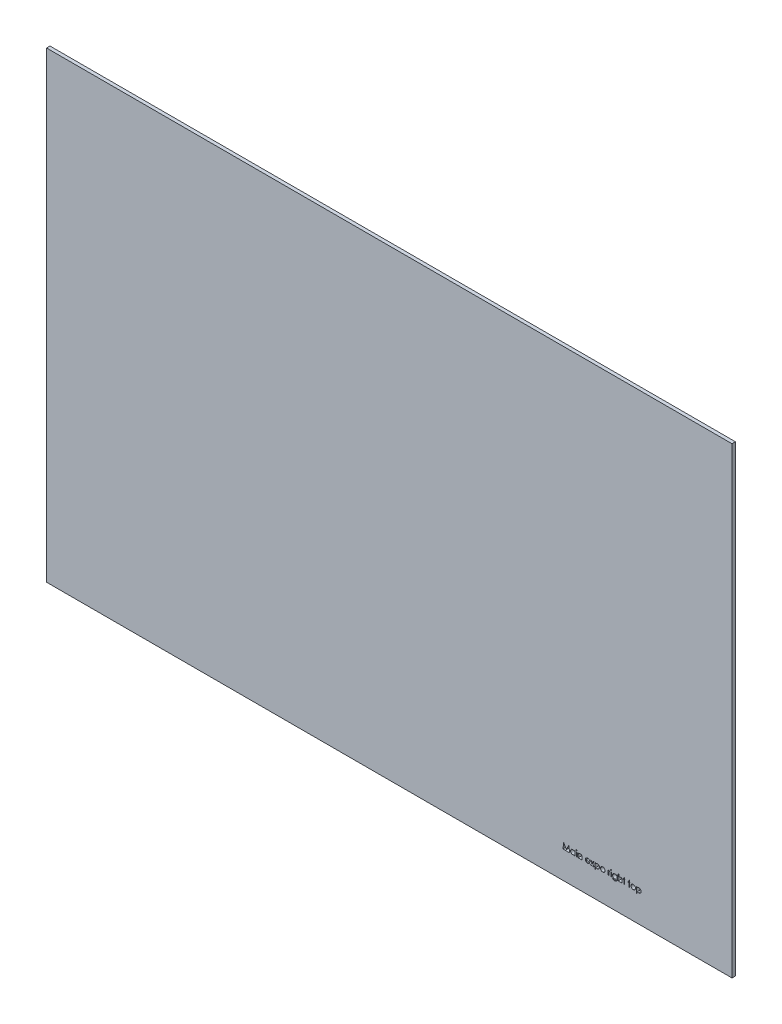
from build123d import *

# Parameters (mm, degrees)
SKETCH1_W           = 400
SKETCH1_H           = 270
SKETCH1_W_2         = 0.314102564
SKETCH1_H_2         = 2.557692307
BOSS_EXTRUDE1_DEPTH = 2


with BuildPart() as part:
    # Sketch1 → Boss-Extrude1 (new body)
    with BuildSketch(Plane.XY):
        with Locations((200, -135)):
            Rectangle(SKETCH1_W, SKETCH1_H)
        with BuildLine():
            Line((319.995968107, -255.076583311), (319.995968107, -254.134275618))
            Line((319.995968107, -254.134275618), (319.995968107, -251.576583311))
            Line((319.995968107, -251.576583311), (320.310070671, -251.576583311))
            Line((320.310070671, -251.576583311), (320.310070671, -252.049840522))
            add(Edge.make_bspline(
                [(320.310070671, -252.049840522), (320.372235907, -251.964531074), (320.476663599, -251.848597496), (320.637941677, -251.724426255), (320.765057448, -251.65299669), (320.899490655, -251.599232933), (321.090725815, -251.545083732), (321.241803533, -251.532032963), (321.343524197, -251.531711516)],
                knots=[0, 0, 0, 0, 0.263044683, 0.386061082, 0.505770653, 0.625178031, 0.746147722, 1, 1, 1, 1], degree=3))
            add(Edge.make_bspline(
                [(321.343524197, -251.531711516), (321.433156928, -251.532609638), (321.566440546, -251.542569377), (321.73787464, -251.583337397), (321.859440999, -251.626704901), (321.976704515, -251.680369288), (322.087926497, -251.748083907), (322.194840071, -251.826490765), (322.29475631, -251.916722734), (322.38707746, -252.014351041), (322.46692443, -252.119373365), (322.535793493, -252.228335836), (322.591474208, -252.342928363), (322.635043597, -252.462245964), (322.677017831, -252.629991443), (322.687762725, -252.760597629), (322.6882758, -252.848418247)],
                knots=[0, 0, 0, 0, 0.128636051, 0.190652902, 0.252125037, 0.313446276, 0.375227279, 0.438498083, 0.5032851, 0.568009687, 0.630878982, 0.692153504, 0.75255215, 0.813191094, 0.8739854, 1, 1, 1, 1], degree=3))
            add(Edge.make_bspline(
                [(322.6882758, -252.848418247), (322.68807256, -252.937927497), (322.676551747, -253.070614701), (322.635897379, -253.241335405), (322.592882575, -253.362612068), (322.537229457, -253.478595879), (322.469528043, -253.589202236), (322.389640712, -253.694395935), (322.298339823, -253.792748894), (322.199286828, -253.883347975), (322.093409334, -253.962586881), (321.982350481, -254.029125216), (321.866678034, -254.084719337), (321.774567384, -254.1165056), (321.721723316, -254.131166929), (321.709885967, -254.134275618)],
                knots=[0, 0, 0, 0, 0.128034164, 0.189573725, 0.250579835, 0.311733221, 0.37325008, 0.435762516, 0.500345561, 0.564949367, 0.627527909, 0.68915729, 0.749865012, 0.8107602, 0.828257924, 0.828257924, 0.828257924, 0.828257924], degree=3))
            add(Edge.make_bspline(
                [(321.709885967, -254.134275618), (321.680091316, -254.142100201), (321.562862278, -254.168565726), (321.442587513, -254.178824696), (321.353339902, -254.179147413)],
                knots=[0.828257924, 0.828257924, 0.828257924, 0.828257924, 0.872299761, 1, 1, 1, 1], degree=3))
            add(Edge.make_bspline(
                [(321.353339902, -254.179147413), (321.252869694, -254.180307326), (321.134853659, -254.166667728), (321.019952148, -254.138824764), (321.002728251, -254.134275618)],
                knots=[0, 0, 0, 0, 0.250547782, 0.295016817, 0.295016817, 0.295016817, 0.295016817], degree=3))
            Line((321.002728251, -254.134275618), (320.310070671, -254.134275618))
            Line((320.310070671, -254.134275618), (320.310070671, -255.076583311))
            Line((320.310070671, -255.076583311), (319.995968107, -255.076583311))
        make_face(mode=Mode.SUBTRACT)
        with BuildLine():
            Line((332.535646453, -254.134275618), (331.537835094, -254.134275618))
            add(Edge.make_bspline(
                [(331.537835094, -254.134275618), (331.479680934, -254.134540059), (331.39302235, -254.128306537), (331.279037529, -254.110758262), (331.195429259, -254.091703257), (331.113173797, -254.067204444), (331.032406164, -254.03658962), (330.952472649, -254.00197398), (330.874826148, -253.961201318), (330.800240018, -253.915838973), (330.729276833, -253.866700093), (330.662308294, -253.814041802), (330.599971804, -253.757344863), (330.542349133, -253.69669133), (330.488665264, -253.632727777), (330.439807922, -253.564561036), (330.394774513, -253.493434077), (330.355717034, -253.418873157), (330.3214324, -253.342495047), (330.291623967, -253.264463145), (330.267854932, -253.184515888), (330.249717439, -253.102704848), (330.231505925, -252.990517565), (330.227252695, -252.904600959), (330.226737338, -252.847016003)],
                knots=[0, 0, 0, 0, 0.085222258, 0.127202284, 0.169025313, 0.210882033, 0.252962678, 0.295628285, 0.338553294, 0.381463248, 0.423581562, 0.465066165, 0.506312219, 0.547039505, 0.587675833, 0.628674786, 0.669946465, 0.711035574, 0.751995829, 0.792672607, 0.833446018, 0.874190607, 0.915493583, 1, 1, 1, 1], degree=3))
            add(Edge.make_bspline(
                [(330.226737338, -252.847016003), (330.226464852, -252.789083269), (330.232806195, -252.702929503), (330.25003313, -252.589510855), (330.270214112, -252.506803918), (330.294543809, -252.425179379), (330.324665449, -252.345238866), (330.360884731, -252.266958372), (330.401894337, -252.190279836), (330.447978469, -252.116232222), (330.498510939, -252.045905576), (330.553552816, -251.979817404), (330.612344731, -251.917300982), (330.675604548, -251.85895949), (330.743299541, -251.804934523), (330.814762421, -251.754320505), (330.890214671, -251.708209136), (330.968492058, -251.667427006), (331.047605883, -251.630213984), (331.12860409, -251.600681421), (331.209976732, -251.574652595), (331.293156266, -251.556238694), (331.405260538, -251.53714447), (331.490716063, -251.531776726), (331.5476508, -251.531711516)],
                knots=[0, 0, 0, 0, 0.083905433, 0.125068934, 0.16615847, 0.207210273, 0.248490732, 0.289878112, 0.332169514, 0.374475842, 0.41622498, 0.457609587, 0.49907317, 0.540553362, 0.582248849, 0.62454975, 0.667432801, 0.710322543, 0.752467119, 0.794064757, 0.835215707, 0.876228344, 0.917446189, 1, 1, 1, 1], degree=3))
            add(Edge.make_bspline(
                [(331.5476508, -251.531711516), (331.640531381, -251.531863906), (331.77868943, -251.544955171), (331.956285329, -251.590323045), (332.084188836, -251.638284072), (332.209060718, -251.703862889), (332.377592631, -251.823461064), (332.488472606, -251.940243821), (332.560070671, -252.023899016)],
                knots=[0, 0, 0, 0, 0.238762229, 0.354754859, 0.470359399, 0.589144099, 0.716328905, 1, 1, 1, 1], degree=3))
            Line((332.560070671, -252.023899016), (332.560070671, -251.576583311))
            Line((332.560070671, -251.576583311), (332.874173235, -251.576583311))
            Line((332.874173235, -251.576583311), (332.874173235, -253.606330907))
            add(Edge.make_bspline(
                [(332.874173235, -253.606330907), (332.873722516, -253.68975743), (332.872661296, -253.81057464), (332.861386146, -253.965171401), (332.853096871, -254.05780118), (332.845702438, -254.113056729), (332.842503185, -254.134275618)],
                knots=[0, 0, 0, 0, 0.315488713, 0.456290824, 0.58586415, 0.666969388, 0.666969388, 0.666969388, 0.666969388], degree=3))
            add(Edge.make_bspline(
                [(332.842503185, -254.134275618), (332.840986131, -254.144337405), (332.834909414, -254.182593869), (332.818497, -254.269179699), (332.798128101, -254.344552122), (332.780924037, -254.390886195)],
                knots=[0.666969388, 0.666969388, 0.666969388, 0.666969388, 0.705428686, 0.813370713, 1, 1, 1, 1], degree=3))
            add(Edge.make_bspline(
                [(332.780924037, -254.390886195), (332.760248172, -254.447986981), (332.722622072, -254.530186413), (332.660149905, -254.631989833), (332.607370328, -254.702437215), (332.548222241, -254.767409466), (332.484142708, -254.828334183), (332.41387198, -254.883918146), (332.337453416, -254.933203529), (332.256647741, -254.977590447), (332.171501657, -255.016037482), (332.082495187, -255.049522547), (331.988792407, -255.074612179), (331.891861743, -255.096320454), (331.7546507, -255.115620125), (331.649267336, -255.12197483), (331.577799037, -255.121455106)],
                knots=[0, 0, 0, 0, 0.120906468, 0.179423665, 0.237606687, 0.295938468, 0.354218227, 0.413537067, 0.474086783, 0.535121189, 0.596987665, 0.660019834, 0.724277496, 0.79001185, 0.857747684, 1, 1, 1, 1], degree=3))
            add(Edge.make_bspline(
                [(331.577799037, -255.121455106), (331.474425993, -255.122811659), (331.322960115, -255.109694402), (331.127977585, -255.071836642), (330.994401737, -255.030185934), (330.87113211, -254.979135226), (330.759007697, -254.920543806), (330.659038179, -254.853353097), (330.568908834, -254.776854764), (330.48758963, -254.685882906), (330.38003632, -254.535459342), (330.313251955, -254.406108783), (330.271609133, -254.313762798)],
                knots=[0, 0, 0, 0, 0.188473675, 0.276839915, 0.362136562, 0.443436755, 0.520165521, 0.592709664, 0.662917334, 0.7354188, 0.81488097, 1, 1, 1, 1], degree=3))
            Line((330.271609133, -254.313762798), (330.585711697, -254.313762798))
            add(Edge.make_bspline(
                [(330.585711697, -254.313762798), (330.631798719, -254.394086677), (330.716407758, -254.503068478), (330.853963056, -254.62050614), (330.967379876, -254.690463303), (331.093619245, -254.743126709), (331.286332854, -254.795408981), (331.441352104, -254.806851959), (331.5476508, -254.807352541)],
                knots=[0, 0, 0, 0, 0.243805374, 0.360061534, 0.475112, 0.593525098, 0.71935017, 1, 1, 1, 1], degree=3))
            add(Edge.make_bspline(
                [(331.5476508, -254.807352541), (331.653031522, -254.806800902), (331.80684535, -254.795259382), (331.998431579, -254.743120503), (332.122988418, -254.690548394), (332.232045007, -254.626089123), (332.326056804, -254.554091177), (332.40220152, -254.472909656), (332.453414498, -254.398127968), (332.485249071, -254.331503822), (332.50552147, -254.274151231), (332.521994729, -254.209298345), (332.53108144, -254.161741137), (332.535376899, -254.135911988), (332.535646453, -254.134275618)],
                knots=[0, 0, 0, 0, 0.189264436, 0.274463056, 0.355023171, 0.430920462, 0.501086045, 0.566607627, 0.629720863, 0.662710695, 0.698765562, 0.738610537, 0.782581228, 0.785554543, 0.785554543, 0.785554543, 0.785554543], degree=3))
        make_face(mode=Mode.SUBTRACT)
        with BuildLine():
            Line((344.316480928, -255.076583311), (344.316480928, -254.134275618))
            Line((344.316480928, -254.134275618), (344.316480928, -251.576583311))
            Line((344.316480928, -251.576583311), (344.630583492, -251.576583311))
            Line((344.630583492, -251.576583311), (344.630583492, -252.049840522))
            add(Edge.make_bspline(
                [(344.630583492, -252.049840522), (344.692748727, -251.964531074), (344.797176419, -251.848597496), (344.958454498, -251.724426255), (345.085570268, -251.65299669), (345.220003475, -251.599232933), (345.411238635, -251.545083732), (345.562316354, -251.532032963), (345.664037018, -251.531711516)],
                knots=[0, 0, 0, 0, 0.263044683, 0.386061082, 0.505770653, 0.625178031, 0.746147722, 1, 1, 1, 1], degree=3))
            add(Edge.make_bspline(
                [(345.664037018, -251.531711516), (345.753669748, -251.532609638), (345.886953367, -251.542569377), (346.058387461, -251.583337397), (346.179953819, -251.626704901), (346.297217336, -251.680369288), (346.408439317, -251.748083907), (346.515352891, -251.826490765), (346.61526913, -251.916722734), (346.707590281, -252.014351041), (346.78743725, -252.119373365), (346.856306313, -252.228335836), (346.911987028, -252.342928363), (346.955556417, -252.462245964), (346.997530651, -252.629991443), (347.008275545, -252.760597629), (347.00878862, -252.848418247)],
                knots=[0, 0, 0, 0, 0.128636051, 0.190652902, 0.252125037, 0.313446276, 0.375227279, 0.438498083, 0.5032851, 0.568009687, 0.630878982, 0.692153504, 0.75255215, 0.813191094, 0.8739854, 1, 1, 1, 1], degree=3))
            add(Edge.make_bspline(
                [(347.00878862, -252.848418247), (347.008585381, -252.937927497), (346.997064568, -253.070614701), (346.956410199, -253.241335405), (346.913395395, -253.362612068), (346.857742277, -253.478595879), (346.790040863, -253.589202236), (346.710153533, -253.694395935), (346.618852644, -253.792748894), (346.519799649, -253.883347975), (346.413922155, -253.962586881), (346.302863301, -254.029125216), (346.187190855, -254.084719337), (346.095080205, -254.1165056), (346.042236137, -254.131166929), (346.030398788, -254.134275618)],
                knots=[0, 0, 0, 0, 0.128034164, 0.189573725, 0.250579835, 0.311733221, 0.37325008, 0.435762516, 0.500345561, 0.564949367, 0.627527909, 0.68915729, 0.749865012, 0.8107602, 0.828257924, 0.828257924, 0.828257924, 0.828257924], degree=3))
            add(Edge.make_bspline(
                [(346.030398788, -254.134275618), (346.000604136, -254.142100201), (345.883375098, -254.168565726), (345.763100334, -254.178824696), (345.673852723, -254.179147413)],
                knots=[0.828257924, 0.828257924, 0.828257924, 0.828257924, 0.872299761, 1, 1, 1, 1], degree=3))
            add(Edge.make_bspline(
                [(345.673852723, -254.179147413), (345.573382515, -254.180307326), (345.455366479, -254.166667728), (345.340464969, -254.138824764), (345.323241072, -254.134275618)],
                knots=[0, 0, 0, 0, 0.250547782, 0.295016817, 0.295016817, 0.295016817, 0.295016817], degree=3))
            Line((345.323241072, -254.134275618), (344.630583492, -254.134275618))
            Line((344.630583492, -254.134275618), (344.630583492, -255.076583311))
            Line((344.630583492, -255.076583311), (344.316480928, -255.076583311))
        make_face(mode=Mode.SUBTRACT)
        Polygon((301.64550737, -254.134275618), (301.329301441, -254.134275618), (301.791340703, -250.634275618), (301.836212498, -250.634275618), (303.281224518, -253.50607049), (304.722730928, -250.634275618), (304.768303844, -250.634275618), (305.233147594, -254.134275618), (304.917642787, -254.134275618), (303.319085094, -254.134275618), (303.248271793, -254.134275618), align=None, mode=Mode.SUBTRACT)
        with BuildLine():
            add(Edge.make_bspline(
                [(307.105142787, -254.179147413), (307.016113375, -254.178929314), (306.896102302, -254.168499992), (306.779102683, -254.142095512), (306.749312124, -254.134275618)],
                knots=[0, 0, 0, 0, 0.127433484, 0.171490765, 0.171490765, 0.171490765, 0.171490765], degree=3))
            add(Edge.make_bspline(
                [(306.749312124, -254.134275618), (306.737469977, -254.131167106), (306.684620394, -254.116511138), (306.59250591, -254.084717858), (306.476833535, -254.029125471), (306.365773497, -253.962587374), (306.259900804, -253.883345677), (306.160829205, -253.792757888), (306.069597444, -253.69436284), (305.98953531, -253.589417297), (305.922785362, -253.478375036), (305.86695368, -253.362641709), (305.824000635, -253.241327439), (305.783324059, -253.070620258), (305.771817125, -252.937924603), (305.771609133, -252.848418247)],
                knots=[0.171490765, 0.171490765, 0.171490765, 0.171490765, 0.189004127, 0.249930071, 0.310668454, 0.372328961, 0.43493911, 0.499575544, 0.564191208, 0.626735217, 0.688109334, 0.749293607, 0.810330528, 0.87190117, 1, 1, 1, 1], degree=3))
            add(Edge.make_bspline(
                [(305.771609133, -252.848418247), (305.772126786, -252.760600483), (305.782858261, -252.629985932), (305.824854092, -252.462253916), (305.868363059, -252.342898651), (305.924215406, -252.228558153), (305.992140665, -252.119154246), (306.072160576, -252.014384828), (306.164412766, -251.916713559), (306.264347587, -251.826493135), (306.371256333, -251.748083394), (306.482479508, -251.680369065), (306.599742924, -251.62670629), (306.721308504, -251.583332026), (306.892521139, -251.542652541), (307.02554526, -251.532509137), (307.114958492, -251.531711516)],
                knots=[0, 0, 0, 0, 0.12607881, 0.186904093, 0.247573935, 0.308003356, 0.369131898, 0.432033228, 0.496790794, 0.561610823, 0.624913866, 0.686726349, 0.748078833, 0.809582291, 0.871630743, 1, 1, 1, 1], degree=3))
            add(Edge.make_bspline(
                [(307.114958492, -251.531711516), (307.217151175, -251.532010486), (307.368894506, -251.545130551), (307.560892283, -251.599109485), (307.695555358, -251.652971118), (307.822691908, -251.724661935), (307.984614908, -251.847816075), (308.087884307, -251.964882651), (308.149814261, -252.049840522)],
                knots=[0, 0, 0, 0, 0.254653531, 0.376014554, 0.495255252, 0.614797719, 0.738105554, 1, 1, 1, 1], degree=3))
            Line((308.149814261, -252.049840522), (308.149814261, -251.576583311))
            Line((308.149814261, -251.576583311), (308.463916825, -251.576583311))
            Line((308.463916825, -251.576583311), (308.463916825, -254.134275618))
            Line((308.463916825, -254.134275618), (308.149814261, -254.134275618))
            Line((308.149814261, -254.134275618), (307.470279114, -254.134275618))
            add(Edge.make_bspline(
                [(307.470279114, -254.134275618), (307.448256384, -254.139956853), (307.328429012, -254.167735765), (307.205378966, -254.179954764), (307.105142787, -254.179147413)],
                knots=[0.69099225, 0.69099225, 0.69099225, 0.69099225, 0.748144942, 1, 1, 1, 1], degree=3))
        make_face(mode=Mode.SUBTRACT)
        with Locations((309.29404503, -252.855429464)):
            Rectangle(SKETCH1_W_2, SKETCH1_H_2, mode=Mode.SUBTRACT)
        with BuildLine():
            Line((310.528019389, -254.134275618), (310.213916825, -254.134275618))
            Line((310.213916825, -254.134275618), (310.213916825, -251.576583311))
            Line((310.213916825, -251.576583311), (310.528019389, -251.576583311))
            Line((310.528019389, -251.576583311), (310.528019389, -252.037921452))
            add(Edge.make_bspline(
                [(310.528019389, -252.037921452), (310.591376194, -251.95571419), (310.692270972, -251.840793587), (310.849590011, -251.720232767), (310.969562557, -251.650097328), (311.09519104, -251.597306085), (311.270692969, -251.545715486), (311.408726762, -251.532187756), (311.501176441, -251.531711516)],
                knots=[0, 0, 0, 0, 0.273568781, 0.398988314, 0.519929781, 0.638110022, 0.756588901, 1, 1, 1, 1], degree=3))
            add(Edge.make_bspline(
                [(311.501176441, -251.531711516), (311.593552086, -251.532323291), (311.731428226, -251.547325765), (311.902000026, -251.610077573), (312.018614485, -251.673235056), (312.123743046, -251.751855964), (312.216067546, -251.843429958), (312.29243088, -251.948767057), (312.343628246, -252.046489961), (312.377353838, -252.133178792), (312.398586384, -252.207425533), (312.416616472, -252.290143687), (312.432252044, -252.381083275), (312.442813009, -252.480881467), (312.454445776, -252.630608044), (312.458286521, -252.747399011), (312.457506569, -252.828085715)],
                knots=[0, 0, 0, 0, 0.15117814, 0.223487984, 0.295542644, 0.366976255, 0.437130525, 0.507043616, 0.578559734, 0.616613545, 0.658756237, 0.704491226, 0.754803115, 0.809331625, 0.868274455, 1, 1, 1, 1], degree=3))
            Line((312.457506569, -252.828085715), (312.457506569, -254.134275618))
            Line((312.457506569, -254.134275618), (312.143404005, -254.134275618))
            Line((312.143404005, -254.134275618), (310.528019389, -254.134275618))
        make_face(mode=Mode.SUBTRACT)
        with BuildLine():
            add(Edge.make_bspline(
                [(309.002378364, -250.770293247), (309.0022192, -250.734673793), (309.013462379, -250.681261348), (309.049594114, -250.618478044), (309.087025647, -250.57744173), (309.131670639, -250.543236721), (309.198739258, -250.508842827), (309.255240246, -250.499423645), (309.292642787, -250.499660234)],
                knots=[0, 0, 0, 0, 0.242149081, 0.363437476, 0.489745393, 0.618114845, 0.744893781, 1, 1, 1, 1], degree=3))
            add(Edge.make_bspline(
                [(309.292642787, -250.499660234), (309.330641021, -250.499734466), (309.388041962, -250.508432425), (309.455751945, -250.543223486), (309.50034011, -250.577668206), (309.538542112, -250.618227771), (309.57454589, -250.681335319), (309.585912852, -250.734635817), (309.585711697, -250.770293247)],
                knots=[0, 0, 0, 0, 0.258284092, 0.384341125, 0.511979615, 0.638632008, 0.759229763, 1, 1, 1, 1], degree=3))
            add(Edge.make_bspline(
                [(309.585711697, -250.770293247), (309.585785992, -250.805233454), (309.5744734, -250.857696663), (309.538313964, -250.919648383), (309.500364658, -250.960128778), (309.45574547, -250.994554569), (309.388046376, -251.029352274), (309.330638715, -251.038046133), (309.292642787, -251.038121772)],
                knots=[0, 0, 0, 0, 0.23754632, 0.357497051, 0.484917122, 0.613329268, 0.74015037, 1, 1, 1, 1], degree=3))
            add(Edge.make_bspline(
                [(309.292642787, -251.038121772), (309.255242535, -251.038356958), (309.198734877, -251.028941863), (309.131677174, -250.994541281), (309.087000975, -250.96035539), (309.049819756, -250.919400108), (309.013536781, -250.857768842), (309.002344512, -250.80519691), (309.002378364, -250.770293247)],
                knots=[0, 0, 0, 0, 0.256661403, 0.384213213, 0.513365233, 0.640443152, 0.761085005, 1, 1, 1, 1], degree=3))
        make_face(mode=Mode.SUBTRACT)
        with BuildLine():
            add(Edge.make_bspline(
                [(315.718424037, -254.179147413), (315.622653357, -254.17910853), (315.496527983, -254.169266821), (315.373628852, -254.141835972), (315.344616788, -254.134275618)],
                knots=[0, 0, 0, 0, 0.139629225, 0.183293708, 0.183293708, 0.183293708, 0.183293708], degree=3))
            add(Edge.make_bspline(
                [(315.344616788, -254.134275618), (315.330329522, -254.13055245), (315.27421201, -254.114880992), (315.179289766, -254.081040218), (315.064547088, -254.023602591), (314.958046343, -253.953645843), (314.859226798, -253.871512847), (314.771202553, -253.776496604), (314.691958834, -253.674814601), (314.622032414, -253.568858699), (314.563577156, -253.458895583), (314.516016576, -253.34562465), (314.477641179, -253.229762274), (314.441559895, -253.06931513), (314.43278027, -252.945463323), (314.431865543, -252.862440682)],
                knots=[0.183293708, 0.183293708, 0.183293708, 0.183293708, 0.204796697, 0.268134963, 0.329813747, 0.391301398, 0.453433515, 0.51655169, 0.579631271, 0.641118921, 0.701294047, 0.760810336, 0.819931722, 0.878919575, 1, 1, 1, 1], degree=3))
            add(Edge.make_bspline(
                [(314.431865543, -252.862440682), (314.432818831, -252.78464698), (314.440094911, -252.66851812), (314.471722291, -252.517974409), (314.503869724, -252.409086717), (314.545448825, -252.303546468), (314.613621602, -252.166035431), (314.678785435, -252.06996616), (314.726336697, -252.008474336)],
                knots=[0, 0, 0, 0, 0.2537679, 0.377428427, 0.500550841, 0.623295883, 0.746578332, 1, 1, 1, 1], degree=3))
            add(Edge.make_bspline(
                [(314.726336697, -252.008474336), (314.786909757, -251.932749787), (314.885677733, -251.826867952), (315.040339885, -251.716105425), (315.161916908, -251.648065879), (315.292258342, -251.59643335), (315.478804368, -251.543938947), (315.626680165, -251.532910096), (315.726136377, -251.531711516)],
                knots=[0, 0, 0, 0, 0.253589335, 0.374643257, 0.495340042, 0.616324775, 0.739759335, 1, 1, 1, 1], degree=3))
            add(Edge.make_bspline(
                [(315.726136377, -251.531711516), (315.828963879, -251.531279542), (315.980872139, -251.546159748), (316.173465202, -251.599448998), (316.307309548, -251.654534629), (316.43297906, -251.725746376), (316.591254235, -251.844817162), (316.694697149, -251.954456852), (316.756084293, -252.035116965)],
                knots=[0, 0, 0, 0, 0.259032841, 0.381879824, 0.502258444, 0.62275219, 0.744742632, 1, 1, 1, 1], degree=3))
            add(Edge.make_bspline(
                [(316.756084293, -252.035116965), (316.801970945, -252.094005788), (316.861879985, -252.189644951), (316.925490753, -252.326430973), (316.963867531, -252.435312707), (316.994877664, -252.549139058), (317.025479148, -252.711495176), (317.032840181, -252.837477515), (317.034429646, -252.922737157)],
                knots=[0, 0, 0, 0, 0.236254763, 0.356174434, 0.477249655, 0.601539871, 0.729618382, 1, 1, 1, 1], degree=3))
            Line((317.034429646, -252.922737157), (314.745968107, -252.922737157))
            add(Edge.make_bspline(
                [(314.745968107, -252.922737157), (314.747756832, -252.988983168), (314.756637178, -253.086839426), (314.786917709, -253.212052717), (314.818163474, -253.299135297), (314.856036388, -253.382065544), (314.902420485, -253.460227553), (314.957760478, -253.533265478), (315.019486057, -253.601832664), (315.088193187, -253.662893236), (315.160475916, -253.717545701), (315.237369518, -253.763348776), (315.318267471, -253.800538038), (315.403039746, -253.829609109), (315.523021811, -253.856675569), (315.616150062, -253.865394533), (315.679161216, -253.865044849)],
                knots=[0, 0, 0, 0, 0.134475588, 0.198391058, 0.260753477, 0.321829223, 0.383037238, 0.444653123, 0.507398011, 0.569825238, 0.630777641, 0.690928687, 0.750945133, 0.811049477, 0.872330853, 1, 1, 1, 1], degree=3))
            add(Edge.make_bspline(
                [(315.679161216, -253.865044849), (315.74135512, -253.86534568), (315.834651353, -253.858022619), (315.956499646, -253.832503037), (316.045760389, -253.80664476), (316.131331201, -253.775059529), (316.210577099, -253.736959017), (316.283456043, -253.694807875), (316.351577662, -253.646601517), (316.417629502, -253.587580192), (316.511127291, -253.48276126), (316.578243061, -253.393130795), (316.620767787, -253.326583311)],
                knots=[0, 0, 0, 0, 0.163878894, 0.24565874, 0.327725695, 0.408609961, 0.485749086, 0.559169056, 0.630268476, 0.705306028, 0.792064966, 1, 1, 1, 1], degree=3))
            Line((316.620767787, -253.326583311), (316.899814261, -253.473117766))
            add(Edge.make_bspline(
                [(316.899814261, -253.473117766), (316.858313425, -253.5508104), (316.788842434, -253.659806286), (316.68189655, -253.789568441), (316.596823557, -253.871314859), (316.507145951, -253.942561808), (316.412415364, -254.004901325), (316.312126049, -254.058017407), (316.207141293, -254.102412291), (316.134408023, -254.124778042), (316.09765242, -254.134275618)],
                knots=[0, 0, 0, 0, 0.181660766, 0.265874227, 0.346354784, 0.424599862, 0.501903184, 0.579992091, 0.658443431, 0.736737234, 0.736737234, 0.736737234, 0.736737234], degree=3))
            add(Edge.make_bspline(
                [(316.09765242, -254.134275618), (316.096744019, -254.134510347), (316.05675504, -254.144795466), (315.93159431, -254.170482032), (315.804717829, -254.179136253), (315.718424037, -254.179147413)],
                knots=[0.736737234, 0.736737234, 0.736737234, 0.736737234, 0.738672236, 0.821894148, 1, 1, 1, 1], degree=3))
        make_face(mode=Mode.SUBTRACT)
        Polygon((317.677358332, -254.134275618), (317.303660415, -254.134275618), (318.283828684, -252.760778022), (317.4382758, -251.576583311), (317.811973716, -251.576583311), (318.470327082, -252.499259593), (319.128680447, -251.576583311), (319.502378364, -251.576583311), (318.657526601, -252.760778022), (319.636993748, -254.134275618), (319.263295832, -254.134275618), align=None, mode=Mode.SUBTRACT)
        with BuildLine():
            add(Edge.make_bspline(
                [(324.55185753, -254.179147413), (324.458451914, -254.178725321), (324.333507417, -254.169223476), (324.21167591, -254.142176757), (324.181506232, -254.134275618)],
                knots=[0, 0, 0, 0, 0.134635192, 0.179537829, 0.179537829, 0.179537829, 0.179537829], degree=3))
            add(Edge.make_bspline(
                [(324.181506232, -254.134275618), (324.168883847, -254.130969942), (324.114495343, -254.115805579), (324.020688085, -254.082439396), (323.903542817, -254.027135086), (323.793756428, -253.958526006), (323.690556501, -253.877965142), (323.59548445, -253.785829401), (323.50948612, -253.685819391), (323.433612117, -253.580669368), (323.369725398, -253.471259265), (323.317354005, -253.357376605), (323.276571375, -253.239517783), (323.237939778, -253.075128993), (323.226230431, -252.9480081), (323.226737338, -252.862440682)],
                knots=[0.179537829, 0.179537829, 0.179537829, 0.179537829, 0.198324187, 0.260825013, 0.322713588, 0.384554535, 0.446912858, 0.510957633, 0.574930701, 0.636684538, 0.697483115, 0.757133808, 0.816965664, 0.876818352, 1, 1, 1, 1], degree=3))
            add(Edge.make_bspline(
                [(323.226737338, -252.862440682), (323.227231605, -252.777733885), (323.23677922, -252.651741571), (323.273792106, -252.489230683), (323.312482822, -252.373299986), (323.362031173, -252.261568261), (323.443186448, -252.116815314), (323.520884936, -252.017699978), (323.577298235, -251.95518908)],
                knots=[0, 0, 0, 0, 0.255237725, 0.378678596, 0.501087887, 0.622713679, 0.746240795, 1, 1, 1, 1], degree=3))
            add(Edge.make_bspline(
                [(323.577298235, -251.95518908), (323.638916924, -251.886344262), (323.741437393, -251.794503148), (323.893439619, -251.694982735), (324.013120957, -251.635451361), (324.138815638, -251.58867971), (324.317664259, -251.544333581), (324.457290223, -251.53084816), (324.55185753, -251.531711516)],
                knots=[0, 0, 0, 0, 0.252712986, 0.374819133, 0.496436426, 0.617910557, 0.741287617, 1, 1, 1, 1], degree=3))
            add(Edge.make_bspline(
                [(324.55185753, -251.531711516), (324.645947692, -251.530736875), (324.785173864, -251.544302557), (324.963298993, -251.588946528), (325.089094906, -251.63415244), (325.20747455, -251.694880653), (325.359838548, -251.792426984), (325.461453854, -251.885149109), (325.523612338, -251.953085715)],
                knots=[0, 0, 0, 0, 0.258332351, 0.382133976, 0.503804392, 0.624692987, 0.74687059, 1, 1, 1, 1], degree=3))
            add(Edge.make_bspline(
                [(325.523612338, -251.953085715), (325.580643348, -252.015423635), (325.657037411, -252.115362075), (325.739276811, -252.259722866), (325.788380886, -252.371941372), (325.827023055, -252.488322573), (325.864215038, -252.651261873), (325.873698847, -252.777503836), (325.874173235, -252.862440682)],
                knots=[0, 0, 0, 0, 0.253834363, 0.376505623, 0.498533686, 0.621367729, 0.744564745, 1, 1, 1, 1], degree=3))
            add(Edge.make_bspline(
                [(325.874173235, -252.862440682), (325.874680145, -252.948008102), (325.862970792, -253.075128987), (325.824339203, -253.239517791), (325.783556549, -253.357376575), (325.73118525, -253.471259377), (325.667298169, -253.580668937), (325.591425558, -253.685821054), (325.505421836, -253.785822947), (325.410369893, -253.87798896), (325.307253736, -253.958317961), (325.1980998, -254.027136805), (325.081456065, -254.082583252), (324.987807218, -254.115815681), (324.933402689, -254.130969003), (324.920767839, -254.134275618)],
                knots=[0, 0, 0, 0, 0.123336979, 0.18326514, 0.243172443, 0.302898354, 0.363773598, 0.425605305, 0.489659043, 0.553784577, 0.616221533, 0.677854471, 0.739516897, 0.802096536, 0.820924402, 0.820924402, 0.820924402, 0.820924402], degree=3))
            add(Edge.make_bspline(
                [(324.920767839, -254.134275618), (324.890608908, -254.14216839), (324.769250995, -254.169122326), (324.64480758, -254.178783448), (324.55185753, -254.179147413)],
                knots=[0.820924402, 0.820924402, 0.820924402, 0.820924402, 0.865865841, 1, 1, 1, 1], degree=3))
        make_face(mode=Mode.SUBTRACT)
        with BuildLine():
            Line((328.072891184, -254.134275618), (327.75878862, -254.134275618))
            Line((327.75878862, -254.134275618), (327.75878862, -251.576583311))
            Line((327.75878862, -251.576583311), (328.072891184, -251.576583311))
            Line((328.072891184, -251.576583311), (328.072891184, -251.953085715))
            add(Edge.make_bspline(
                [(328.072891184, -251.953085715), (328.115911312, -251.885371756), (328.183863515, -251.791604071), (328.289660408, -251.68891301), (328.367296271, -251.630384731), (328.447677302, -251.586624392), (328.555250594, -251.543947183), (328.640809189, -251.532100532), (328.696889582, -251.531711516)],
                knots=[0, 0, 0, 0, 0.306112383, 0.438366514, 0.560541455, 0.675317225, 0.786113634, 1, 1, 1, 1], degree=3))
            add(Edge.make_bspline(
                [(328.696889582, -251.531711516), (328.741866035, -251.532060937), (328.838332865, -251.548953938), (328.925985977, -251.592491849), (328.970327082, -251.61935174)],
                knots=[0, 0, 0, 0, 0.463523195, 1, 1, 1, 1], degree=3))
            Line((328.970327082, -251.61935174), (328.79785112, -251.891386997))
            add(Edge.make_bspline(
                [(328.79785112, -251.891386997), (328.769238082, -251.878716663), (328.717765424, -251.855461024), (328.661978269, -251.846136469), (328.637294229, -251.84581408)],
                knots=[0, 0, 0, 0, 0.560229945, 1, 1, 1, 1], degree=3))
            add(Edge.make_bspline(
                [(328.637294229, -251.84581408), (328.585769204, -251.845747557), (328.506889954, -251.864625239), (328.411946842, -251.921460553), (328.353772387, -251.969645512), (328.308730578, -252.016206045), (328.276590151, -252.056851632), (328.247107874, -252.102431151), (328.218935835, -252.152160226), (328.193276902, -252.206891672), (328.160425462, -252.287946517), (328.140904075, -252.352424396), (328.128980928, -252.396895811)],
                knots=[0, 0, 0, 0, 0.191338128, 0.295190617, 0.410312337, 0.471930251, 0.536425159, 0.603118728, 0.674117672, 0.749332023, 0.828283384, 1, 1, 1, 1], degree=3))
            add(Edge.make_bspline(
                [(328.128980928, -252.396895811), (328.117231109, -252.441553644), (328.105767155, -252.516725707), (328.093543395, -252.626465089), (328.086395228, -252.729401713), (328.079842077, -252.846017449), (328.074567798, -253.029273026), (328.072344727, -253.173719636), (328.072891184, -253.274700298)],
                knots=[0, 0, 0, 0, 0.15693815, 0.258600395, 0.37589093, 0.508166168, 0.656237809, 1, 1, 1, 1], degree=3))
            Line((328.072891184, -253.274700298), (328.072891184, -254.134275618))
        make_face(mode=Mode.SUBTRACT)
        with Locations((329.396609133, -252.855429464)):
            Rectangle(SKETCH1_W_2, SKETCH1_H_2, mode=Mode.SUBTRACT)
        with BuildLine():
            add(Edge.make_bspline(
                [(329.104942466, -250.770293247), (329.104783302, -250.734673793), (329.116026482, -250.681261348), (329.152158217, -250.618478044), (329.189589749, -250.57744173), (329.234234741, -250.543236721), (329.30130336, -250.508842827), (329.357804349, -250.499423645), (329.395206889, -250.499660234)],
                knots=[0, 0, 0, 0, 0.242149081, 0.363437476, 0.489745393, 0.618114845, 0.744893781, 1, 1, 1, 1], degree=3))
            add(Edge.make_bspline(
                [(329.395206889, -250.499660234), (329.433205124, -250.499734466), (329.490606064, -250.508432425), (329.558316047, -250.543223486), (329.602904213, -250.577668206), (329.641106215, -250.618227771), (329.677109993, -250.681335319), (329.688476954, -250.734635817), (329.6882758, -250.770293247)],
                knots=[0, 0, 0, 0, 0.258284092, 0.384341125, 0.511979615, 0.638632008, 0.759229763, 1, 1, 1, 1], degree=3))
            add(Edge.make_bspline(
                [(329.6882758, -250.770293247), (329.688350094, -250.805233454), (329.677037503, -250.857696663), (329.640878067, -250.919648383), (329.602928761, -250.960128778), (329.558309573, -250.994554569), (329.490610479, -251.029352274), (329.433202817, -251.038046133), (329.395206889, -251.038121772)],
                knots=[0, 0, 0, 0, 0.23754632, 0.357497051, 0.484917122, 0.613329268, 0.74015037, 1, 1, 1, 1], degree=3))
            add(Edge.make_bspline(
                [(329.395206889, -251.038121772), (329.357806638, -251.038356958), (329.301298979, -251.028941863), (329.234241277, -250.994541281), (329.189565077, -250.96035539), (329.152383858, -250.919400108), (329.116100884, -250.857768842), (329.104908614, -250.80519691), (329.104942466, -250.770293247)],
                knots=[0, 0, 0, 0, 0.256661403, 0.384213213, 0.513365233, 0.640443152, 0.761085005, 1, 1, 1, 1], degree=3))
        make_face(mode=Mode.SUBTRACT)
        with BuildLine():
            Line((333.906224518, -254.134275618), (333.592121953, -254.134275618))
            Line((333.592121953, -254.134275618), (333.592121953, -250.544532029))
            Line((333.592121953, -250.544532029), (333.906224518, -250.544532029))
            Line((333.906224518, -250.544532029), (333.906224518, -252.059656227))
            add(Edge.make_bspline(
                [(333.906224518, -252.059656227), (333.96938902, -251.975659768), (334.074064725, -251.862434), (334.229592953, -251.735627011), (334.349914267, -251.661704981), (334.474974746, -251.603419839), (334.649752813, -251.547576301), (334.787422088, -251.531901432), (334.879381569, -251.531711516)],
                knots=[0, 0, 0, 0, 0.273995891, 0.40068416, 0.522554679, 0.641533771, 0.759969143, 1, 1, 1, 1], degree=3))
            add(Edge.make_bspline(
                [(334.879381569, -251.531711516), (334.971753595, -251.532326813), (335.109640206, -251.547319096), (335.280195372, -251.610087093), (335.396856056, -251.673199589), (335.501682116, -251.751886823), (335.594531526, -251.842714577), (335.670372412, -251.947989507), (335.721971531, -252.045245511), (335.755544885, -252.131784301), (335.776796917, -252.206020805), (335.794815232, -252.288742719), (335.810518756, -252.379907457), (335.820966275, -252.479952604), (335.832695509, -252.630136968), (335.836490645, -252.747166988), (335.835711697, -252.828085715)],
                knots=[0, 0, 0, 0, 0.151154907, 0.223453638, 0.295497225, 0.366919857, 0.436794085, 0.506696431, 0.577863847, 0.61591181, 0.658048026, 0.703775986, 0.754080143, 0.808979421, 0.867913193, 1, 1, 1, 1], degree=3))
            Line((335.835711697, -252.828085715), (335.835711697, -254.134275618))
            Line((335.835711697, -254.134275618), (335.521609133, -254.134275618))
            Line((335.521609133, -254.134275618), (333.906224518, -254.134275618))
        make_face(mode=Mode.SUBTRACT)
        Polygon((337.181865543, -254.134275618), (336.867762979, -254.134275618), (336.867762979, -251.890685875), (336.41904503, -251.890685875), (336.41904503, -251.576583311), (336.867762979, -251.576583311), (336.867762979, -250.544532029), (337.181865543, -250.544532029), (337.181865543, -251.576583311), (337.630583492, -251.576583311), (337.630583492, -251.890685875), (337.181865543, -251.890685875), align=None, mode=Mode.SUBTRACT)
        Polygon((340.143404005, -254.134275618), (339.829301441, -254.134275618), (339.829301441, -251.890685875), (339.380583492, -251.890685875), (339.380583492, -251.576583311), (339.829301441, -251.576583311), (339.829301441, -250.544532029), (340.143404005, -250.544532029), (340.143404005, -251.576583311), (340.592121953, -251.576583311), (340.592121953, -251.890685875), (340.143404005, -251.890685875), align=None, mode=Mode.SUBTRACT)
        with BuildLine():
            add(Edge.make_bspline(
                [(342.365960094, -254.179147413), (342.272554478, -254.178725321), (342.147609981, -254.169223476), (342.025778474, -254.142176757), (341.995608796, -254.134275618)],
                knots=[0, 0, 0, 0, 0.134635192, 0.179537829, 0.179537829, 0.179537829, 0.179537829], degree=3))
            add(Edge.make_bspline(
                [(341.995608796, -254.134275618), (341.982986411, -254.130969942), (341.928597907, -254.115805579), (341.834790649, -254.082439396), (341.717645381, -254.027135086), (341.607858992, -253.958526006), (341.504659065, -253.877965142), (341.409587014, -253.785829401), (341.323588684, -253.685819391), (341.247714682, -253.580669368), (341.183827962, -253.471259265), (341.131456569, -253.357376605), (341.090673939, -253.239517783), (341.052042342, -253.075128993), (341.040332995, -252.9480081), (341.040839902, -252.862440682)],
                knots=[0.179537829, 0.179537829, 0.179537829, 0.179537829, 0.198324187, 0.260825013, 0.322713588, 0.384554535, 0.446912858, 0.510957633, 0.574930701, 0.636684538, 0.697483115, 0.757133808, 0.816965664, 0.876818352, 1, 1, 1, 1], degree=3))
            add(Edge.make_bspline(
                [(341.040839902, -252.862440682), (341.041334169, -252.777733885), (341.050881785, -252.651741571), (341.08789467, -252.489230683), (341.126585386, -252.373299986), (341.176133737, -252.261568261), (341.257289012, -252.116815314), (341.3349875, -252.017699978), (341.3914008, -251.95518908)],
                knots=[0, 0, 0, 0, 0.255237725, 0.378678596, 0.501087887, 0.622713679, 0.746240795, 1, 1, 1, 1], degree=3))
            add(Edge.make_bspline(
                [(341.3914008, -251.95518908), (341.453019489, -251.886344262), (341.555539957, -251.794503148), (341.707542183, -251.694982735), (341.827223521, -251.635451361), (341.952918203, -251.58867971), (342.131766823, -251.544333581), (342.271392787, -251.53084816), (342.365960094, -251.531711516)],
                knots=[0, 0, 0, 0, 0.252712986, 0.374819133, 0.496436426, 0.617910557, 0.741287617, 1, 1, 1, 1], degree=3))
            add(Edge.make_bspline(
                [(342.365960094, -251.531711516), (342.460050256, -251.530736875), (342.599276428, -251.544302557), (342.777401557, -251.588946528), (342.90319747, -251.63415244), (343.021577115, -251.694880653), (343.173941112, -251.792426984), (343.275556418, -251.885149109), (343.337714902, -251.953085715)],
                knots=[0, 0, 0, 0, 0.258332351, 0.382133976, 0.503804392, 0.624692987, 0.74687059, 1, 1, 1, 1], degree=3))
            add(Edge.make_bspline(
                [(343.337714902, -251.953085715), (343.394745912, -252.015423635), (343.471139975, -252.115362075), (343.553379375, -252.259722866), (343.60248345, -252.371941372), (343.641125619, -252.488322573), (343.678317602, -252.651261873), (343.687801411, -252.777503836), (343.6882758, -252.862440682)],
                knots=[0, 0, 0, 0, 0.253834363, 0.376505623, 0.498533686, 0.621367729, 0.744564745, 1, 1, 1, 1], degree=3))
            add(Edge.make_bspline(
                [(343.6882758, -252.862440682), (343.688782709, -252.948008102), (343.677073356, -253.075128987), (343.638441768, -253.239517791), (343.597659113, -253.357376575), (343.545287814, -253.471259377), (343.481400733, -253.580668937), (343.405528122, -253.685821054), (343.319524401, -253.785822947), (343.224472457, -253.87798896), (343.121356301, -253.958317961), (343.012202364, -254.027136805), (342.895558629, -254.082583252), (342.801909783, -254.115815681), (342.747505253, -254.130969003), (342.734870403, -254.134275618)],
                knots=[0, 0, 0, 0, 0.123336979, 0.18326514, 0.243172443, 0.302898354, 0.363773598, 0.425605305, 0.489659043, 0.553784577, 0.616221533, 0.677854471, 0.739516897, 0.802096536, 0.820924402, 0.820924402, 0.820924402, 0.820924402], degree=3))
            add(Edge.make_bspline(
                [(342.734870403, -254.134275618), (342.704711473, -254.14216839), (342.583353559, -254.169122326), (342.458910144, -254.178783448), (342.365960094, -254.179147413)],
                knots=[0.820924402, 0.820924402, 0.820924402, 0.820924402, 0.865865841, 1, 1, 1, 1], degree=3))
        make_face(mode=Mode.SUBTRACT)
    extrude(amount=BOSS_EXTRUDE1_DEPTH)


solid = part.part
